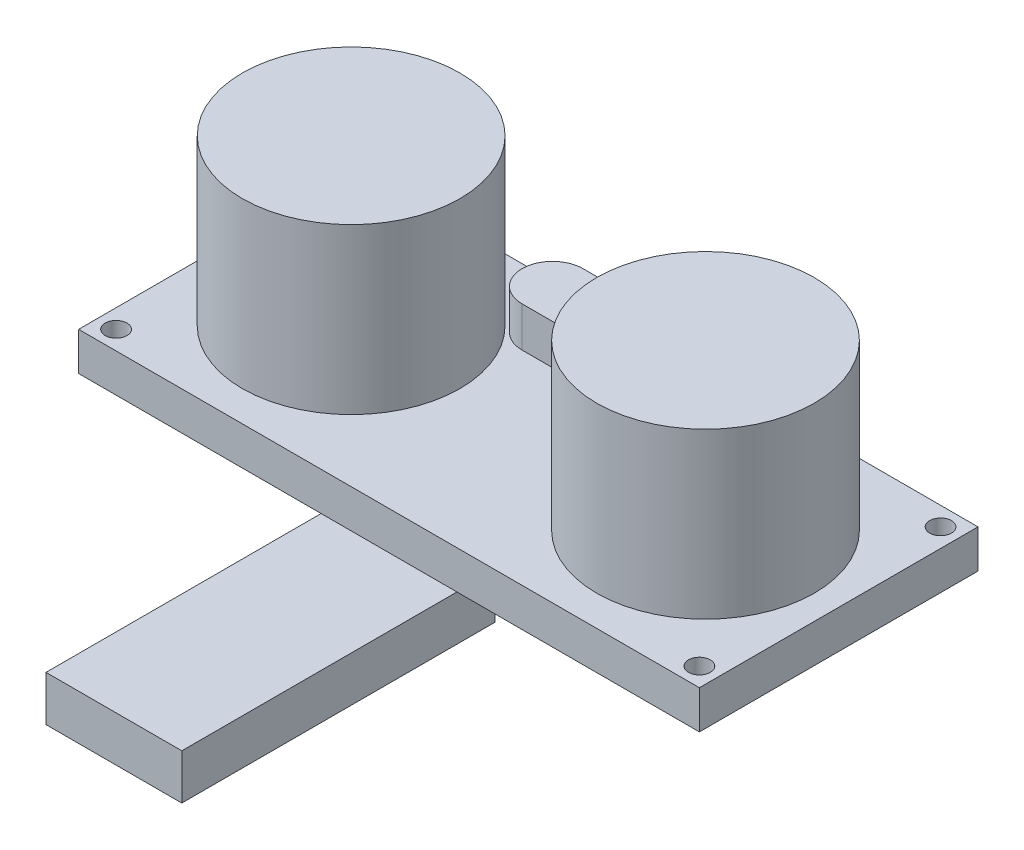
from build123d import *

# Parameters (mm, degrees)
SKETCH1_W           = 45.2755
SKETCH1_H           = 20.32
BOSS_EXTRUDE1_DEPTH = 2.794
SKETCH2_R           = 7.9375
BOSS_EXTRUDE2_DEPTH = 12.0015
BOSS_EXTRUDE3_DEPTH = 2.921
SKETCH5_W           = 9.906
SKETCH5_H           = 20.066
SKETCH5_H_2         = 2.794
BOSS_EXTRUDE4_DEPTH = 3.302
SKETCH6_R           = 0.79375
CUT_EXTRUDE1_DEPTH  = 40.624674173


with BuildPart() as part:
    # Sketch1 → Boss-Extrude1 (new body)
    with BuildSketch(Plane(origin=(0, 0, 0), x_dir=(1, 0, 0), z_dir=(0, 1, 0))):
        Rectangle(SKETCH1_W, SKETCH1_H)
    extrude(amount=BOSS_EXTRUDE1_DEPTH)

    # Sketch2 → Boss-Extrude2 (add)
    with BuildSketch(Plane(origin=(0, 2.794, 0), x_dir=(1, 0, 0), z_dir=(0, 1, 0))):
        with Locations(Location((-12.92225, 0, 0), (0, 0, 270))):
            Circle(SKETCH2_R)
        with Locations(Location((12.92225, 0, 0), (0, 0, 90))):
            Circle(SKETCH2_R)
    extrude(amount=BOSS_EXTRUDE2_DEPTH)

    # Sketch3 → Boss-Extrude3 (add)
    with BuildSketch(Plane(origin=(0, 2.794, 0), x_dir=(1, 0, 0), z_dir=(0, 1, 0))):
        with BuildLine():
            Line((-5.156416146, 9.144), (5.156416146, 9.144))
            ThreePointArc((5.156416146, 9.144), (7.378916146, 6.9215), (5.156416146, 4.699))
            Line((5.156416146, 4.699), (-5.156416146, 4.699))
            ThreePointArc((-5.156416146, 4.699), (-7.378916146, 6.9215), (-5.156416146, 9.144))
        make_face()
    extrude(amount=BOSS_EXTRUDE3_DEPTH)

    # Sketch5 → Boss-Extrude4 (add)
    with BuildSketch(Plane.XZ):
        with Locations((0, 20.193)):
            Rectangle(SKETCH5_W, SKETCH5_H)
        with Locations((0, 8.763)):
            Rectangle(SKETCH5_W, SKETCH5_H_2)
    extrude(amount=BOSS_EXTRUDE4_DEPTH)

    # Sketch6 → Cut-Extrude1 (cut, through all)
    with BuildSketch(Plane(origin=(0, 2.794, 0), x_dir=(1, 0, 0), z_dir=(0, 1, 0))):
        with Locations(Location((-21.2725, 8.79475, 0), (0, 0, 270))):
            Circle(SKETCH6_R)
        with Locations(Location((-21.2725, -8.79475, 0), (0, 0, 270))):
            Circle(SKETCH6_R)
        with Locations(Location((21.2725, -8.79475, 0), (0, 0, 270))):
            Circle(SKETCH6_R)
        with Locations(Location((21.2725, 8.79475, 0), (0, 0, 270))):
            Circle(SKETCH6_R)
    extrude(amount=-CUT_EXTRUDE1_DEPTH, mode=Mode.SUBTRACT)


solid = part.part
